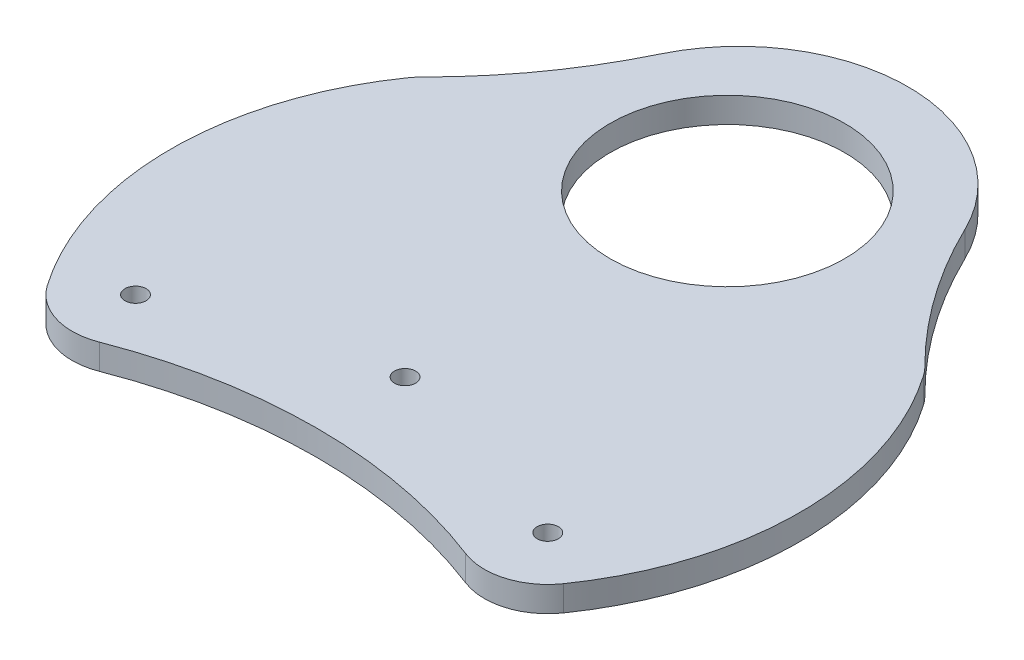
from build123d import *

# Parameters (mm, degrees)
BOSS_EXTRUDE1_DEPTH = 3
SKETCH2_R           = 1.25
SKETCH2_R_2         = 13.875
CUT_EXTRUDE1_DEPTH  = 56.828571826


with BuildPart() as part:
    # Sketch1 → Boss-Extrude1 (new body)
    with BuildSketch(Plane(origin=(0, 0, 0), x_dir=(1, 0, 0), z_dir=(0, 1, 0))):
        with BuildLine():
            ThreePointArc((-30.534150334, -38.289553671), (-37.223372122, -17), (-30.534150334, 4.289553671))
            ThreePointArc((-30.534150334, 4.289553671), (-30.127865646, 4.820197467), (-29.675955722, 5.312566746))
            ThreePointArc((-29.675955722, 5.312566746), (-23.149545378, 13.015308608), (-18.007026439, 21.703275178))
            ThreePointArc((-18.007026439, 21.703275178), (0, 33), (18.007026439, 21.703275178))
            ThreePointArc((18.007026439, 21.703275178), (23.149545378, 13.015308608), (29.675955722, 5.312566746))
            ThreePointArc((29.675955722, 5.312566746), (30.127865646, 4.820197467), (30.534150334, 4.289553671))
            ThreePointArc((30.534150334, 4.289553671), (37.223372122, -17), (30.534150334, -38.289553671))
            ThreePointArc((30.534150334, -38.289553671), (26.570942981, -41.173440783), (21.67283286, -40.993622447))
            ThreePointArc((21.67283286, -40.993622447), (0, -36.942602025), (-21.67283286, -40.993622447))
            ThreePointArc((-21.67283286, -40.993622447), (-26.570942981, -41.173440783), (-30.534150334, -38.289553671))
        make_face()
    extrude(amount=BOSS_EXTRUDE1_DEPTH)

    # Sketch2 → Cut-Extrude1 (cut, through all)
    with BuildSketch(Plane(origin=(0, 3, 0), x_dir=(1, 0, 0), z_dir=(0, 1, 0))):
        with Locations(Location((-24.381936968, -34, 0), (0, 0, 270))):
            Circle(SKETCH2_R)
        with Locations(Location((24.381936968, -34, 0), (0, 0, 270))):
            Circle(SKETCH2_R)
        with Locations(Location((0, -26.5, 0), (0, 0, 270))):
            Circle(SKETCH2_R)
        with Locations(Location((0, 11.63, 0), (0, 0, 270))):
            Circle(SKETCH2_R_2)
    extrude(amount=-CUT_EXTRUDE1_DEPTH, mode=Mode.SUBTRACT)


solid = part.part
